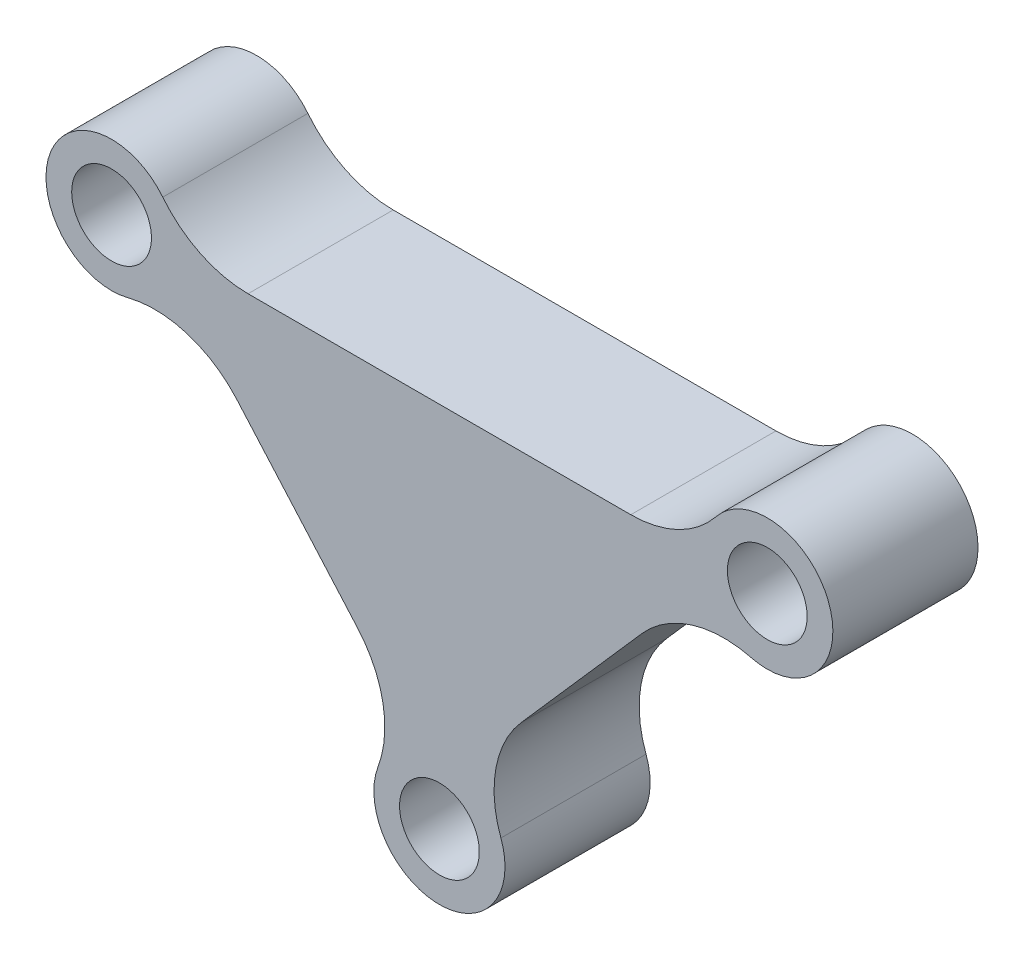
from build123d import *

# Parameters (mm, degrees)
ESQUISSE2_R        = 3
ESQUISSE2_R_2      = 1.825
BOSS_EXTRU_1_DEPTH = 6.64
CONG_1_R           = 5


with BuildPart() as part:
    # Esquisse2 → Boss.-Extru.1 (new body)
    # profile 1 of 4: a face of its own
    with BuildSketch(Plane.XY):
        with Locations((-15, 10)):
            Circle(ESQUISSE2_R)
        with Locations(Location((-15, 10, 0), (0, 0, 180))):
            Circle(ESQUISSE2_R_2, mode=Mode.SUBTRACT)
    # profile 2 of 4: a face of its own
    with BuildSketch(Plane.XY):
        with Locations((15, 10)):
            Circle(ESQUISSE2_R)
        with Locations(Location((15, 10, 0), (0, 0, 180))):
            Circle(ESQUISSE2_R_2, mode=Mode.SUBTRACT)
    # profile 3 of 4: a face of its own
    with BuildSketch(Plane.XY):
        with Locations((0, -6.825)):
            Circle(ESQUISSE2_R)
        with Locations(Location((0, -6.825, 0), (0, 0, 180))):
            Circle(ESQUISSE2_R_2, mode=Mode.SUBTRACT)
    # profile 4 of 4: a face of its own
    with BuildSketch(Plane.XY):
        Polygon((-13.175, 10), (13.175, 10), (0, -5), align=None)
    extrude(amount=BOSS_EXTRU_1_DEPTH)

    # Congé1
    cong_1_edges = [part.edges().sort_by_distance(p)[0] for p in [
        (-12.208908932, 8.900086071, 3.32),
        (-12, 10, 3.32),
        (12, 10, 3.32),
        (12.208908932, 8.900086071, 3.32),
        (0.908352526, -3.965822551, 3.32),
        (-0.908352526, -3.965822551, 3.32),
    ]]
    fillet(cong_1_edges, radius=CONG_1_R)


solid = part.part
